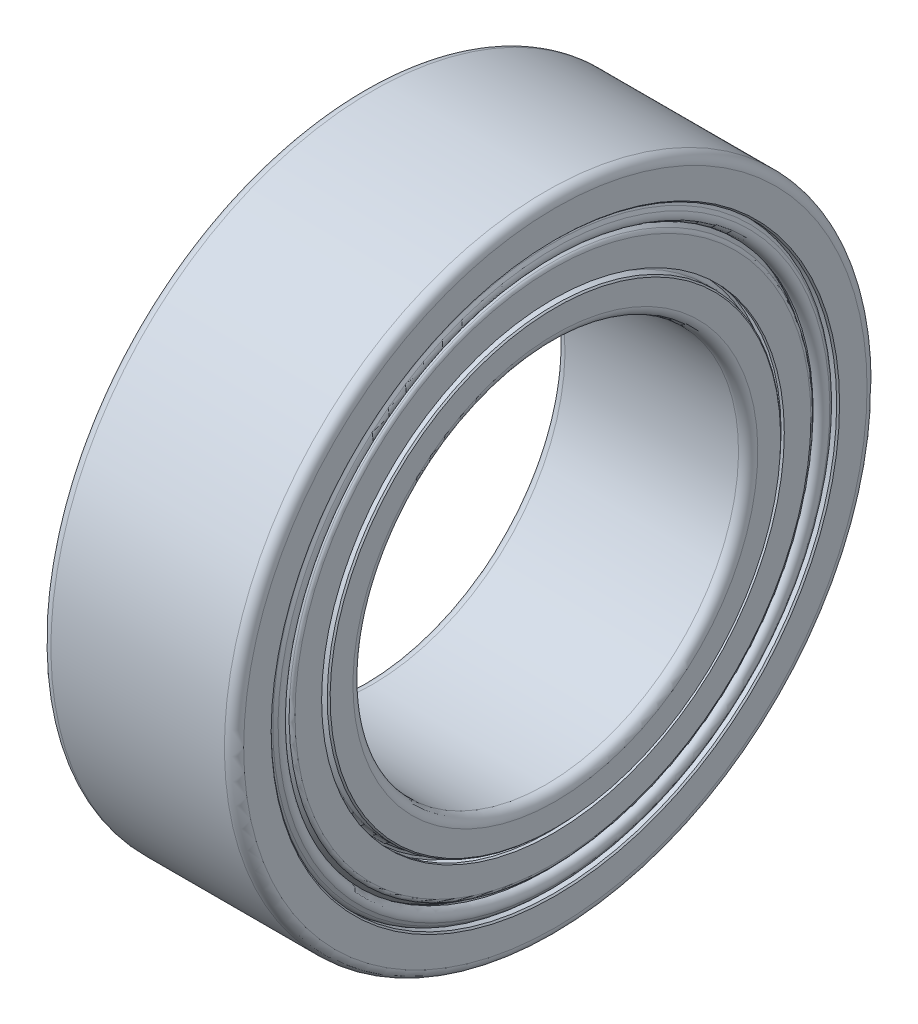
from build123d import *


with BuildPart() as part:
    # Sketch3 → Revolve1 (revolve)
    with BuildSketch(Plane.XY, mode=Mode.PRIVATE) as revolve1_sk:
        with BuildLine():
            Line((-1.35, 5), (1.35, 5))
            ThreePointArc((1.35, 5), (1.456066017, 4.956066017), (1.5, 4.85))
            Line((1.5, 4.85), (1.5, 4.4225))
            Line((1.5, 4.4225), (1.4775, 4.4))
            Line((1.4775, 4.4), (1.275, 4.4))
            Line((1.275, 4.4), (1.275, 4.436))
            Line((1.275, 4.436), (-1.275, 4.436))
            Line((-1.275, 4.436), (-1.275, 4.4))
            Line((-1.275, 4.4), (-1.4775, 4.4))
            Line((-1.4775, 4.4), (-1.5, 4.4225))
            Line((-1.5, 4.4225), (-1.5, 4.85))
            ThreePointArc((-1.5, 4.85), (-1.456066017, 4.956066017), (-1.35, 5))
        make_face()
        with BuildLine():
            Line((-1.4775, 3.527578125), (-1.5, 3.505078125))
            Line((-1.5, 3.505078125), (-1.5, 3.15))
            ThreePointArc((-1.5, 3.15), (-1.456066017, 3.043933983), (-1.35, 3))
            Line((-1.35, 3), (1.35, 3))
            ThreePointArc((1.35, 3), (1.456066017, 3.043933983), (1.5, 3.15))
            Line((1.5, 3.15), (1.5, 3.505078125))
            Line((1.5, 3.505078125), (1.4775, 3.527578125))
            Line((1.4775, 3.527578125), (1.341796875, 3.527578125))
            ThreePointArc((1.341796875, 3.527578125), (1.282099533, 3.547751057), (1.246875, 3.6))
            Line((1.246875, 3.6), (1.246875, 3.636))
            Line((1.246875, 3.636), (-1.246875, 3.636))
            Line((-1.246875, 3.636), (-1.246875, 3.6))
            ThreePointArc((-1.246875, 3.6), (-1.282099533, 3.547751057), (-1.341796875, 3.527578125))
            Line((-1.341796875, 3.527578125), (-1.4775, 3.527578125))
        make_face()
    revolve(revolve1_sk.sketch.rotate(Axis((-1.35, 0, 0), (1, 0, 0)), 180), axis=Axis((-1.35, 0, 0), (1, 0, 0)))


with BuildPart() as body_2:
    # Sketch4 → Revolve-Thin1 (revolve)
    with BuildSketch(Plane.XY, mode=Mode.PRIVATE) as revolve_thin1_sk:
        with BuildLine():
            ThreePointArc((1.3825, 4.178038476), (1.434461524, 4.208038476), (1.434461524, 4.268038476))
            Line((1.434461524, 4.268038476), (1.404461524, 4.32))
            ThreePointArc((1.404461524, 4.32), (1.336970857, 4.34795555), (1.2925, 4.29))
            Line((1.2925, 4.29), (1.2925, 4.160096189))
            ThreePointArc((1.2925, 4.160096189), (1.294509619, 4.152596189), (1.3, 4.147105808))
            Line((1.3, 4.147105808), (1.42875, 4.072771961))
            ThreePointArc((1.42875, 4.072771961), (1.453456715, 4.048065246), (1.4625, 4.014315246))
            Line((1.4625, 4.014315246), (1.4625, 3.6))
            Line((1.4625, 3.6), (1.4125, 3.6))
            Line((1.4125, 3.6), (1.4125, 4.014315246))
            ThreePointArc((1.4125, 4.014315246), (1.410155445, 4.023065246), (1.40375, 4.029470691))
            Line((1.40375, 4.029470691), (1.275, 4.103804538))
            ThreePointArc((1.275, 4.103804538), (1.251208349, 4.127596189), (1.2425, 4.160096189))
            Line((1.2425, 4.160096189), (1.2425, 4.29))
            ThreePointArc((1.2425, 4.29), (1.324029905, 4.396251841), (1.447762794, 4.345))
            Line((1.447762794, 4.345), (1.477762794, 4.293038476))
            ThreePointArc((1.477762794, 4.293038476), (1.477762794, 4.183038476), (1.3825, 4.128038476))
            Line((1.3825, 4.128038476), (1.3825, 4.178038476))
        make_face()
    revolve(revolve_thin1_sk.sketch.rotate(Axis((-1.35, 0, 0), (1, 0, 0)), 180), axis=Axis((-1.35, 0, 0), (1, 0, 0)))


with BuildPart() as body_3:
    # Mirror2: mirrored copy
    add(body_2.part.mirror(Plane(origin=(0, 0, 0), x_dir=(0, 0, 1), z_dir=(1, 0, 0))))


with BuildPart() as body_3_2:
    # Mirror1: mirrored copy
    add(body_2.part.mirror(Plane(origin=(0, 0, 0), x_dir=(0, 0, 1), z_dir=(1, 0, 0))))


solid = Compound([part.part, body_2.part, body_3_2.part])
